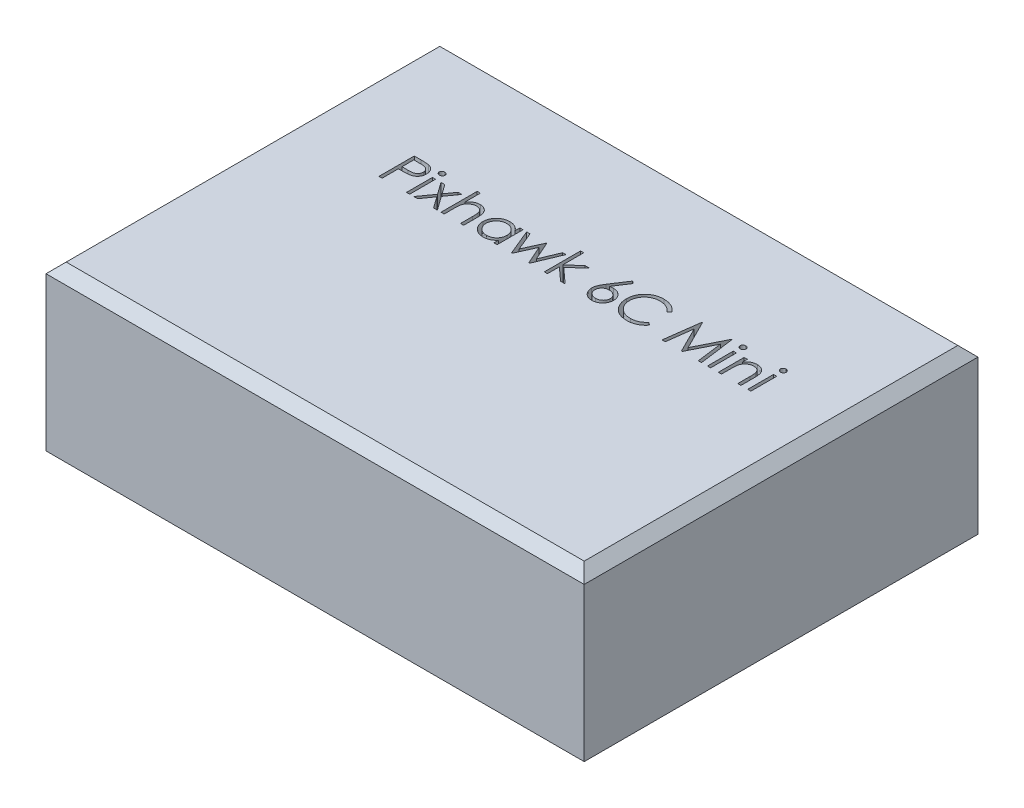
from build123d import *

# Parameters (mm, degrees)
SKETCH_1_W          = 53.3
SKETCH_1_H          = 39
EXTRUDE_1_DEPTH     = 16.2
CHAMFER_1_SIZE      = 1
CHAMFER_2_SIZE      = 1
SKETCH_2_W          = 0.314102564
SKETCH_2_H          = 2.557692308
CUT_EXTRUDE_1_DEPTH = 2


with BuildPart() as part:
    # 草图1 → 凸台-拉伸1 (new body)
    with BuildSketch(Plane(origin=(0, 0, 0), x_dir=(1, 0, 0), z_dir=(0, 1, 0))):
        Rectangle(SKETCH_1_W, SKETCH_1_H)
    extrude(amount=EXTRUDE_1_DEPTH)

    # 倒角1
    chamfer_1_edges = [part.edges().sort_by_distance(p)[0] for p in [
        (0, 16.2, 19.5),
    ]]
    chamfer(chamfer_1_edges, length=CHAMFER_1_SIZE)

    # 倒角2
    chamfer_2_edges = [part.edges().sort_by_distance(p)[0] for p in [
        (26.65, 16.2, -0.5),
        (0, 16.2, -19.5),
        (-26.65, 16.2, -0.5),
    ]]
    chamfer(chamfer_2_edges, length=CHAMFER_2_SIZE)

    # 草图2 → 切除-拉伸1 (cut)
    # profile 1 of 16: a face of its own
    with BuildSketch(Plane(origin=(0, 16.2, 0), x_dir=(1, 0, 0), z_dir=(0, 1, 0))):
        with BuildLine():
            Line((-17.511702096, 7.831163241), (-16.825303859, 7.831163241))
            add(Edge.make_bspline(
                [(-16.825303859, 7.831163241), (-16.778092953, 7.831111345), (-16.68763476, 7.831011909), (-16.557919704, 7.827997163), (-16.440109972, 7.823970471), (-16.334459592, 7.818388578), (-16.240643493, 7.811791988), (-16.159086194, 7.802539948), (-16.089146638, 7.792879653), (-16.047240188, 7.783058246), (-16.028128378, 7.778579106)],
                knots=[0, 0, 0, 0, 1.415646017, 2.712440637, 3.8905458, 4.950247383, 5.884950622, 6.709939814, 7.411656543, 8, 8, 8, 8], degree=3))
            add(Edge.make_bspline(
                [(-16.028128378, 7.778579106), (-16.003934844, 7.771957156), (-15.956117867, 7.758869295), (-15.887216824, 7.732655571), (-15.821662978, 7.701573406), (-15.75923142, 7.666149466), (-15.700689337, 7.624863902), (-15.645163296, 7.579390284), (-15.593143316, 7.528678716), (-15.544921924, 7.473297976), (-15.500637126, 7.414177766), (-15.462507443, 7.350435536), (-15.430580216, 7.283144233), (-15.403196945, 7.212350661), (-15.38348849, 7.137460338), (-15.368641591, 7.058993626), (-15.359217963, 6.976958935), (-15.358315401, 6.920899068), (-15.357855942, 6.892361158)],
                knots=[0, 0, 0, 0, 0.999701418, 1.975846123, 2.934577507, 3.890451536, 4.834027766, 5.787354733, 6.749476667, 7.726910423, 8.712836071, 9.690891519, 10.682875813, 11.679750201, 12.712814741, 13.765529915, 14.8625177, 16, 16, 16, 16], degree=3))
            add(Edge.make_bspline(
                [(-15.357855942, 6.892361158), (-15.358277367, 6.863583381), (-15.359101913, 6.807277717), (-15.368998198, 6.724904929), (-15.38232839, 6.646186538), (-15.402825442, 6.571297088), (-15.429671115, 6.500681318), (-15.461163168, 6.433260086), (-15.499146698, 6.370180414), (-15.542791528, 6.311213296), (-15.591343122, 6.256303384), (-15.644596061, 6.205848589), (-15.702335353, 6.160144251), (-15.764377501, 6.119087907), (-15.83132735, 6.083631628), (-15.902169504, 6.051874323), (-15.97751972, 6.025203262), (-16.029662234, 6.011173201), (-16.05617325, 6.004039843)],
                knots=[0, 0, 0, 0, 1.121902311, 2.195077645, 3.232258892, 4.234102512, 5.217864754, 6.176164875, 7.132989551, 8.084763148, 9.034132444, 9.988522005, 10.94243251, 11.903244335, 12.886203696, 13.894208494, 14.929344452, 16, 16, 16, 16], degree=3))
            add(Edge.make_bspline(
                [(-16.05617325, 6.004039843), (-16.078100584, 5.999376862), (-16.126155611, 5.989157668), (-16.205298333, 5.977749211), (-16.297443719, 5.968011611), (-16.402465999, 5.960710473), (-16.520270904, 5.954460105), (-16.650922161, 5.949492011), (-16.794676239, 5.946762157), (-16.894947483, 5.946621364), (-16.947299051, 5.946547856)],
                knots=[0, 0, 0, 0, 0.601384939, 1.31797006, 2.144135048, 3.087295005, 4.142315834, 5.309527816, 6.595305764, 8, 8, 8, 8], degree=3))
            Line((-16.947299051, 5.946547856), (-17.197599532, 5.946547856))
            Line((-17.197599532, 5.946547856), (-17.197599532, 4.331163241))
            Line((-17.197599532, 4.331163241), (-17.511702096, 4.331163241))
            Line((-17.511702096, 4.331163241), (-17.511702096, 7.831163241))
        make_face()
        with BuildLine():
            Line((-17.197599532, 7.472188882), (-17.197599532, 6.305522215))
            Line((-17.197599532, 6.305522215), (-16.584819083, 6.297809875))
            add(Edge.make_bspline(
                [(-16.584819083, 6.297809875), (-16.554899157, 6.297794412), (-16.497139357, 6.29776456), (-16.413703134, 6.301749783), (-16.336293847, 6.306350316), (-16.265149271, 6.313086239), (-16.200237337, 6.322607497), (-16.141449808, 6.332219235), (-16.089242525, 6.346124597), (-16.028143323, 6.364847666), (-15.960059976, 6.396780282), (-15.885992427, 6.443130172), (-15.823221841, 6.50221088), (-15.768903544, 6.568638712), (-15.725797666, 6.642537841), (-15.694241674, 6.721606778), (-15.675700517, 6.805034627), (-15.673214323, 6.862122766), (-15.671958506, 6.890958914)],
                knots=[0, 0, 0, 0, 1.160613943, 2.240541288, 3.23993089, 4.169200891, 5.011653406, 5.7853311, 6.478053781, 7.106038997, 8.262395093, 9.384106736, 10.481365981, 11.59014053, 12.70357646, 13.786202915, 14.881775077, 16, 16, 16, 16], degree=3))
            add(Edge.make_bspline(
                [(-15.671958506, 6.890958914), (-15.673221153, 6.919097427), (-15.675731138, 6.97503331), (-15.694387001, 7.05701207), (-15.725736315, 7.135247775), (-15.769192909, 7.20822086), (-15.821934039, 7.274409664), (-15.883233382, 7.331906791), (-15.952946644, 7.378128494), (-16.017794875, 7.407961775), (-16.075396061, 7.426177051), (-16.125428021, 7.438921891), (-16.181918695, 7.449097497), (-16.244886475, 7.457337), (-16.313843308, 7.464390461), (-16.389381623, 7.469176439), (-16.471215267, 7.471977895), (-16.528025837, 7.47211685), (-16.557475333, 7.472188882)],
                knots=[0, 0, 0, 0, 1.120700087, 2.227813068, 3.331159281, 4.466773991, 5.599788987, 6.693661531, 7.80175334, 8.91857717, 9.525282508, 10.207424825, 10.974604443, 11.810962634, 12.737642355, 13.736264703, 14.826523623, 16, 16, 16, 16], degree=3))
            Line((-16.557475333, 7.472188882), (-17.197599532, 7.472188882))
        make_face(mode=Mode.SUBTRACT)
    # profile 2 of 16: a face of its own
    with BuildSketch(Plane(origin=(0, 16.2, 0), x_dir=(1, 0, 0), z_dir=(0, 1, 0))):
        with BuildLine():
            add(Edge.make_bspline(
                [(-14.61887357, 7.965778625), (-14.599382255, 7.964874473), (-14.561214515, 7.963103969), (-14.506021247, 7.947942492), (-14.455764235, 7.922242807), (-14.411186502, 7.887763126), (-14.372934615, 7.847213682), (-14.346153905, 7.799952714), (-14.328941509, 7.748894075), (-14.326862954, 7.713278986), (-14.32580466, 7.695145613)],
                knots=[0, 0, 0, 0, 1.055194115, 2.066272739, 3.074728998, 4.095836921, 5.109056067, 6.073838105, 7.019297344, 8, 8, 8, 8], degree=3))
            add(Edge.make_bspline(
                [(-14.32580466, 7.695145613), (-14.32688682, 7.677482959), (-14.329026122, 7.642565984), (-14.34614061, 7.592392512), (-14.373162848, 7.545788229), (-14.411161973, 7.505317519), (-14.455770734, 7.470856899), (-14.50601952, 7.44515216), (-14.561214969, 7.429992022), (-14.599382408, 7.428221334), (-14.61887357, 7.427317087)],
                knots=[0, 0, 0, 0, 0.96129708, 1.900370562, 2.859976407, 3.87933698, 4.906634145, 5.921202961, 6.938410037, 8, 8, 8, 8], degree=3))
            add(Edge.make_bspline(
                [(-14.61887357, 7.427317087), (-14.638141845, 7.428186807), (-14.675645026, 7.429879604), (-14.730011868, 7.445449622), (-14.779840357, 7.470865695), (-14.82450503, 7.50509188), (-14.861735223, 7.546036777), (-14.888833549, 7.592364071), (-14.90590851, 7.642573226), (-14.908053139, 7.677485392), (-14.909137993, 7.695145613)],
                knots=[0, 0, 0, 0, 1.054934014, 2.053291228, 3.073705704, 4.106921865, 5.123545215, 6.088680038, 7.033164197, 8, 8, 8, 8], degree=3))
            add(Edge.make_bspline(
                [(-14.909137993, 7.695145613), (-14.908076907, 7.713276462), (-14.905992866, 7.748886595), (-14.88882075, 7.799981628), (-14.861960942, 7.84696313), (-14.824480378, 7.887988629), (-14.779846918, 7.922234064), (-14.730010173, 7.947645045), (-14.675645473, 7.963216385), (-14.638141997, 7.964908999), (-14.61887357, 7.965778625)],
                knots=[0, 0, 0, 0, 0.98631895, 1.937192651, 2.907499808, 3.917963147, 4.944918757, 5.95915025, 6.951458133, 8, 8, 8, 8], degree=3))
        make_face()
    # profile 3 of 16: a face of its own
    with BuildSketch(Plane(origin=(0, 16.2, 0), x_dir=(1, 0, 0), z_dir=(0, 1, 0))):
        with Locations((-14.617471327, 5.610009395)):
            Rectangle(SKETCH_2_W, SKETCH_2_H)
    # profile 4 of 16: a face of its own
    with BuildSketch(Plane(origin=(0, 16.2, 0), x_dir=(1, 0, 0), z_dir=(0, 1, 0))):
        Polygon((-13.921958506, 6.888855549), (-13.54826059, 6.888855549), (-12.889907224, 5.966179266), (-12.231553859, 6.888855549), (-11.857855942, 6.888855549), (-12.702707705, 5.704660837), (-11.723240557, 4.331163241), (-12.096938474, 4.331163241), (-12.889907224, 5.442441286), (-13.682875974, 4.331163241), (-14.056573891, 4.331163241), (-13.076405622, 5.704660837), align=None)
    # profile 5 of 16: a face of its own
    with BuildSketch(Plane(origin=(0, 16.2, 0), x_dir=(1, 0, 0), z_dir=(0, 1, 0))):
        with BuildLine():
            Line((-11.364266198, 7.920906831), (-11.050163634, 7.920906831))
            Line((-11.050163634, 7.920906831), (-11.050163634, 6.405782632))
            add(Edge.make_bspline(
                [(-11.050163634, 6.405782632), (-11.016446333, 6.447926614), (-10.950797019, 6.529983107), (-10.840300902, 6.637044298), (-10.72683003, 6.729842919), (-10.60646522, 6.803713376), (-10.4814147, 6.862069919), (-10.351151055, 6.903457566), (-10.215650084, 6.928908662), (-10.123624934, 6.93210708), (-10.077006583, 6.933727343)],
                knots=[0, 0, 0, 0, 1.125788106, 2.19196713, 3.20547328, 4.180437432, 5.132270164, 6.079753143, 7.027236121, 8, 8, 8, 8], degree=3))
            add(Edge.make_bspline(
                [(-10.077006583, 6.933727343), (-10.02967619, 6.931981913), (-9.937039195, 6.928565685), (-9.802157732, 6.901552304), (-9.676196857, 6.855394866), (-9.559531014, 6.792227841), (-9.454706317, 6.713555014), (-9.361856553, 6.622723491), (-9.286015754, 6.517449573), (-9.234416637, 6.420193319), (-9.200843229, 6.333654565), (-9.179591403, 6.259418053), (-9.161572205, 6.176696139), (-9.145872469, 6.085531407), (-9.135408887, 5.985486236), (-9.127004269, 5.877011981), (-9.121027815, 5.760114863), (-9.120796211, 5.679194614), (-9.120676455, 5.637353145)],
                knots=[0, 0, 0, 0, 1.235656852, 2.418478516, 3.575258207, 4.727955599, 5.870717718, 6.98870536, 8.107142894, 9.245821548, 9.854588956, 10.528768408, 11.260415777, 12.065282286, 12.943670737, 13.886611085, 14.907229059, 16, 16, 16, 16], degree=3))
            Line((-9.120676455, 5.637353145), (-9.120676455, 4.331163241))
            Line((-9.120676455, 4.331163241), (-9.434779019, 4.331163241))
            Line((-9.434779019, 4.331163241), (-9.434779019, 5.534288241))
            add(Edge.make_bspline(
                [(-9.434779019, 5.534288241), (-9.434969322, 5.56911091), (-9.43533334, 5.635720751), (-9.436536684, 5.731086859), (-9.4392229, 5.817582994), (-9.443563725, 5.894931945), (-9.448129033, 5.963241549), (-9.45441235, 6.022412603), (-9.461722584, 6.072526379), (-9.468291365, 6.102691007), (-9.471237352, 6.116219331)],
                knots=[0, 0, 0, 0, 1.430932559, 2.737130458, 3.918967929, 4.986496826, 5.920444988, 6.731744033, 7.431208747, 8, 8, 8, 8], degree=3))
            add(Edge.make_bspline(
                [(-9.471237352, 6.116219331), (-9.482661597, 6.155913594), (-9.504624642, 6.232225585), (-9.555672619, 6.335887995), (-9.61943163, 6.424272736), (-9.697278892, 6.496187024), (-9.787837256, 6.552598563), (-9.89169722, 6.591666345), (-10.007881289, 6.615914067), (-10.08973276, 6.618353371), (-10.132395205, 6.619624779)],
                knots=[0, 0, 0, 0, 1.090059168, 2.095632401, 3.037101401, 3.955032261, 4.878929692, 5.839099886, 6.873700383, 8, 8, 8, 8], degree=3))
            add(Edge.make_bspline(
                [(-10.132395205, 6.619624779), (-10.157662978, 6.619148953), (-10.207667248, 6.618207305), (-10.281815914, 6.608753406), (-10.353744978, 6.593304688), (-10.424147156, 6.572400149), (-10.491530353, 6.543954613), (-10.557858678, 6.511024423), (-10.621252887, 6.470716168), (-10.682838704, 6.425490401), (-10.740156237, 6.375420641), (-10.793483353, 6.322573686), (-10.841021693, 6.266298722), (-10.884090284, 6.207498606), (-10.92126857, 6.145366812), (-10.953721652, 6.080502494), (-10.981257348, 6.012820348), (-10.99494004, 5.965845287), (-11.001786231, 5.942341125)],
                knots=[0, 0, 0, 0, 1.024319606, 2.027102035, 3.025350316, 4.005802111, 5.00026367, 5.987881639, 7.005602596, 8.042517216, 9.083927026, 10.089214625, 11.084353441, 12.06828073, 13.041928858, 14.016821737, 15.00770877, 16, 16, 16, 16], degree=3))
            add(Edge.make_bspline(
                [(-11.001786231, 5.942341125), (-11.005725658, 5.925320175), (-11.014310155, 5.888229428), (-11.023624988, 5.827055104), (-11.031962785, 5.755968732), (-11.039011334, 5.675078131), (-11.043334421, 5.584086889), (-11.047992661, 5.48361593), (-11.049726675, 5.373035909), (-11.050013628, 5.296140402), (-11.050163634, 5.255942888)],
                knots=[0, 0, 0, 0, 0.607992626, 1.324890765, 2.152360218, 3.099583803, 4.150613268, 5.323148443, 6.60066238, 8, 8, 8, 8], degree=3))
            Line((-11.050163634, 5.255942888), (-11.050163634, 4.331163241))
            Line((-11.050163634, 4.331163241), (-11.364266198, 4.331163241))
            Line((-11.364266198, 4.331163241), (-11.364266198, 7.920906831))
        make_face()
    # profile 6 of 16: a face of its own
    with BuildSketch(Plane(origin=(0, 16.2, 0), x_dir=(1, 0, 0), z_dir=(0, 1, 0))):
        with BuildLine():
            Line((-5.800163634, 6.888855549), (-5.800163634, 4.331163241))
            Line((-5.800163634, 4.331163241), (-6.114266198, 4.331163241))
            Line((-6.114266198, 4.331163241), (-6.114266198, 4.773571093))
            add(Edge.make_bspline(
                [(-6.114266198, 4.773571093), (-6.149684989, 4.733531499), (-6.218805204, 4.655393728), (-6.334246322, 4.553311556), (-6.4566145, 4.468933234), (-6.585315821, 4.400783319), (-6.720234065, 4.349591262), (-6.861070152, 4.313205103), (-7.007881533, 4.289811268), (-7.108133888, 4.287475246), (-7.158937673, 4.286291446)],
                knots=[0, 0, 0, 0, 1.074387032, 2.096679803, 3.090159297, 4.057316773, 5.018401886, 5.985159533, 6.978961417, 8, 8, 8, 8], degree=3))
            add(Edge.make_bspline(
                [(-7.158937673, 4.286291446), (-7.204105627, 4.287517818), (-7.293178832, 4.289936279), (-7.424207909, 4.308698582), (-7.550300158, 4.338829204), (-7.671574731, 4.380730093), (-7.787246876, 4.436310915), (-7.898306973, 4.502852163), (-8.004179665, 4.582092993), (-8.103251204, 4.672681022), (-8.194483204, 4.771076009), (-8.274544477, 4.876021556), (-8.341297557, 4.987063859), (-8.397117637, 5.102797013), (-8.440113982, 5.224111933), (-8.470087616, 5.350589101), (-8.488828063, 5.482078974), (-8.491245524, 5.571618497), (-8.492471327, 5.617020613)],
                knots=[0, 0, 0, 0, 1.033919861, 2.038935746, 3.024066025, 3.998881131, 4.97069526, 5.957263378, 6.95902576, 7.993208707, 9.027059324, 10.027763471, 11.009749337, 11.988697705, 12.965288445, 13.950418724, 14.960734635, 16, 16, 16, 16], degree=3))
            add(Edge.make_bspline(
                [(-8.492471327, 5.617020613), (-8.491218355, 5.661484316), (-8.488741298, 5.74938666), (-8.470288079, 5.878665358), (-8.43925707, 6.003183618), (-8.395709222, 6.122540561), (-8.339867267, 6.236880612), (-8.27193918, 6.346284637), (-8.191920056, 6.451054034), (-8.099667649, 6.548725261), (-7.999732878, 6.638945875), (-7.892824148, 6.717354921), (-7.781600866, 6.785071769), (-7.664337856, 6.838725246), (-7.542770751, 6.88213435), (-7.415817305, 6.912167318), (-7.284005726, 6.92986464), (-7.194515234, 6.932427404), (-7.149121968, 6.933727343)],
                knots=[0, 0, 0, 0, 1.020392517, 2.01726096, 2.990465484, 3.961182959, 4.928053699, 5.906110375, 6.912531644, 7.948652711, 8.985773172, 9.998621852, 10.987621588, 11.969261332, 12.953316658, 13.946091881, 14.958173133, 16, 16, 16, 16], degree=3))
            add(Edge.make_bspline(
                [(-7.149121968, 6.933727343), (-7.096922109, 6.932289592), (-6.994560649, 6.929470229), (-6.844832639, 6.906007502), (-6.703188162, 6.866369034), (-6.568533809, 6.812451536), (-6.441353123, 6.740802807), (-6.322850139, 6.650422846), (-6.211784656, 6.541881659), (-6.147404364, 6.458511215), (-6.114266198, 6.415598337)],
                knots=[0, 0, 0, 0, 1.038897134, 2.037228247, 3.008116434, 3.962042015, 4.918381754, 5.904844433, 6.921570401, 8, 8, 8, 8], degree=3))
            Line((-6.114266198, 6.415598337), (-6.114266198, 6.888855549))
            Line((-6.114266198, 6.888855549), (-5.800163634, 6.888855549))
        make_face()
        with BuildLine():
            add(Edge.make_bspline(
                [(-7.144915237, 6.619624779), (-7.190829575, 6.617991142), (-7.281457175, 6.614766601), (-7.414501177, 6.589593105), (-7.541814591, 6.547708511), (-7.662760665, 6.49042661), (-7.775428882, 6.418397873), (-7.876122553, 6.33127649), (-7.965665254, 6.231439476), (-8.040973518, 6.119337365), (-8.102364015, 5.999159274), (-8.145531047, 5.873534836), (-8.174000295, 5.744729859), (-8.176908815, 5.657367173), (-8.178368763, 5.613515004)],
                knots=[0, 0, 0, 0, 1.031046209, 2.035121221, 3.029706178, 4.034933723, 5.034054252, 6.02443088, 7.017295772, 8.038157696, 9.050218397, 10.03989886, 11.016116709, 12, 12, 12, 12], degree=3))
            add(Edge.make_bspline(
                [(-8.178368763, 5.613515004), (-8.176503869, 5.569924896), (-8.172781392, 5.482915541), (-8.146030698, 5.353934964), (-8.101150825, 5.228280922), (-8.039908762, 5.107019928), (-7.963222137, 4.994435828), (-7.874333485, 4.892695705), (-7.772383203, 4.805206117), (-7.659455696, 4.731968543), (-7.538847726, 4.672806023), (-7.412013794, 4.631640383), (-7.281338156, 4.605062602), (-7.192485822, 4.601958126), (-7.147719724, 4.60039401)],
                knots=[0, 0, 0, 0, 0.979072187, 1.954306742, 2.945804271, 3.96968567, 4.997920485, 5.998718438, 6.996577872, 8.005894225, 9.015743152, 10.005417472, 10.995077863, 12, 12, 12, 12], degree=3))
            add(Edge.make_bspline(
                [(-7.147719724, 4.60039401), (-7.102273221, 4.602053974), (-7.011884635, 4.605355478), (-6.878445927, 4.630636743), (-6.748950964, 4.672405541), (-6.625163736, 4.730304668), (-6.509847605, 4.802062024), (-6.406349727, 4.886069115), (-6.318833759, 4.983772299), (-6.244641149, 5.091148752), (-6.186465732, 5.208860749), (-6.144089673, 5.334194939), (-6.119035767, 5.467155687), (-6.115878038, 5.558019614), (-6.114266198, 5.60440042)],
                knots=[0, 0, 0, 0, 1.01762866, 2.023962475, 3.030623092, 4.058876274, 5.077231937, 6.066672613, 7.034107872, 8.005628644, 8.981990164, 9.965428785, 10.961468474, 12, 12, 12, 12], degree=3))
            add(Edge.make_bspline(
                [(-6.114266198, 5.60440042), (-6.115225855, 5.639738251), (-6.117114762, 5.709294284), (-6.131545332, 5.811421802), (-6.154500258, 5.909155528), (-6.186846428, 6.002598217), (-6.229337713, 6.091233232), (-6.280585479, 6.175696992), (-6.341490928, 6.255550204), (-6.411073624, 6.329693275), (-6.487238827, 6.397319737), (-6.567833368, 6.457683978), (-6.653812115, 6.507272751), (-6.743729151, 6.548314022), (-6.837740486, 6.580973172), (-6.936611106, 6.602760866), (-7.039290093, 6.617721187), (-7.109336148, 6.618983568), (-7.144915237, 6.619624779)],
                knots=[0, 0, 0, 0, 1.050140795, 2.067009409, 3.05949893, 4.030605086, 5.00011959, 5.97591094, 6.962425594, 7.979863591, 8.993523472, 9.986985069, 10.967611495, 11.937549037, 12.921786183, 13.919465291, 14.943216303, 16, 16, 16, 16], degree=3))
        make_face(mode=Mode.SUBTRACT)
    # profile 7 of 16: a face of its own
    with BuildSketch(Plane(origin=(0, 16.2, 0), x_dir=(1, 0, 0), z_dir=(0, 1, 0))):
        Polygon((-5.441189275, 6.888855549), (-5.103949692, 6.888855549), (-4.341830301, 5.049111959), (-3.506794243, 6.888855549), (-3.453508987, 6.888855549), (-2.636702096, 5.049111959), (-1.867571487, 6.888855549), (-1.537343122, 6.888855549), (-2.606553859, 4.331163241), (-2.671758186, 4.331163241), (-3.489266198, 6.170906831), (-4.323601134, 4.331163241), (-4.381794243, 4.331163241), align=None)
    # profile 8 of 16: a face of its own
    with BuildSketch(Plane(origin=(0, 16.2, 0), x_dir=(1, 0, 0), z_dir=(0, 1, 0))):
        Polygon((-1.133496968, 7.920906831), (-0.819394404, 7.920906831), (-0.819394404, 5.845586318), (0.344467776, 6.888855549), (0.795990212, 6.888855549), (-0.554370365, 5.677317087), (0.930605596, 4.331163241), (0.479784282, 4.331163241), (-0.819394404, 5.509748978), (-0.819394404, 4.331163241), (-1.133496968, 4.331163241), align=None)
    # profile 9 of 16: a face of its own
    with BuildSketch(Plane(origin=(0, 16.2, 0), x_dir=(1, 0, 0), z_dir=(0, 1, 0))):
        with BuildLine():
            Line((4.026759443, 7.920906831), (4.268646462, 7.730902824))
            Line((4.268646462, 7.730902824), (3.343866814, 6.316740164))
            add(Edge.make_bspline(
                [(3.343866814, 6.316740164), (3.405437091, 6.326554025), (3.525536878, 6.345697069), (3.647102777, 6.348855015), (3.706346782, 6.35039401)],
                knots=[0, 0, 0, 0, 1.025318673, 2, 2, 2, 2], degree=3))
            add(Edge.make_bspline(
                [(3.706346782, 6.35039401), (3.741919279, 6.349437898), (3.811942679, 6.347555821), (3.914749481, 6.33307197), (4.013538417, 6.310246858), (4.107900029, 6.276974602), (4.198173011, 6.234472248), (4.284875407, 6.183533378), (4.366377418, 6.121527697), (4.443728597, 6.052262742), (4.513955694, 5.975545757), (4.57613175, 5.89414442), (4.628358541, 5.808143539), (4.670732463, 5.717586673), (4.703637342, 5.622613414), (4.727624987, 5.523345274), (4.74180458, 5.419713803), (4.74373007, 5.349235628), (4.74470816, 5.313434875)],
                knots=[0, 0, 0, 0, 1.04369286, 2.054478336, 3.041073146, 4.015093852, 4.984733326, 5.965804835, 6.960378782, 7.985147595, 9.009457201, 10.008161701, 10.986880575, 11.956520048, 12.937015923, 13.931873656, 14.949455224, 16, 16, 16, 16], degree=3))
            add(Edge.make_bspline(
                [(4.74470816, 5.313434875), (4.743285056, 5.264455172), (4.740484722, 5.168074706), (4.712580926, 5.027697999), (4.669221281, 4.893965484), (4.607243753, 4.769012312), (4.53026137, 4.653009743), (4.436383777, 4.550224277), (4.328940289, 4.45855424), (4.207453491, 4.381897621), (4.076710527, 4.31929457), (3.939358529, 4.274329328), (3.796731383, 4.246645858), (3.699926775, 4.243175256), (3.65095816, 4.241419651)],
                knots=[0, 0, 0, 0, 1.031375318, 2.029502543, 3.004789286, 3.987476834, 4.960371455, 5.9300674, 6.912260825, 7.929083631, 8.949397511, 9.960523116, 10.96833055, 12, 12, 12, 12], degree=3))
            add(Edge.make_bspline(
                [(3.65095816, 4.241419651), (3.60386146, 4.242947857), (3.510571142, 4.245974965), (3.373338348, 4.272940903), (3.24147533, 4.316648006), (3.115905949, 4.376862284), (2.999585336, 4.452920167), (2.8955197, 4.544482446), (2.804227925, 4.649591911), (2.728253304, 4.768232258), (2.667994573, 4.895722216), (2.622804647, 5.028659372), (2.596408404, 5.166559354), (2.592719847, 5.260040493), (2.590862007, 5.307124779)],
                knots=[0, 0, 0, 0, 1.012016664, 2.004627821, 2.994792927, 3.992885782, 4.990978636, 5.973936114, 6.964471063, 7.975201453, 8.993600317, 9.990122807, 10.98767138, 12, 12, 12, 12], degree=3))
            add(Edge.make_bspline(
                [(2.590862007, 5.307124779), (2.592043452, 5.343169363), (2.594455737, 5.416765515), (2.611299127, 5.528229542), (2.638363922, 5.642280624), (2.668674168, 5.739034818), (2.700699778, 5.81829634), (2.727352318, 5.88219983), (2.760526314, 5.947960904), (2.795899695, 6.01783454), (2.836656564, 6.090019972), (2.880972213, 6.165723642), (2.930071864, 6.243741569), (2.964492027, 6.296685765), (2.982087968, 6.323751382)],
                knots=[0, 0, 0, 0, 1.173818275, 2.396712641, 3.66331629, 4.989737886, 5.693666774, 6.447286557, 7.243889047, 8.091586357, 8.998013824, 9.943181721, 10.948533338, 12, 12, 12, 12], degree=3))
            Line((2.982087968, 6.323751382), (4.026759443, 7.920906831))
        make_face()
        with BuildLine():
            add(Edge.make_bspline(
                [(3.640441334, 5.991419651), (3.613779089, 5.990641607), (3.561699979, 5.989121862), (3.485292565, 5.98029661), (3.412979313, 5.963677545), (3.343802179, 5.942511213), (3.279054477, 5.913408153), (3.218265637, 5.878056354), (3.161200585, 5.836435176), (3.108457033, 5.789134265), (3.06063737, 5.737346232), (3.019456239, 5.68187671), (2.983933839, 5.624062506), (2.95505202, 5.563420564), (2.932561944, 5.499974065), (2.916293693, 5.434014815), (2.907239942, 5.365100509), (2.905733711, 5.318368006), (2.904964571, 5.294504587)],
                knots=[0, 0, 0, 0, 1.129588631, 2.206414736, 3.251139165, 4.268635594, 5.265702196, 6.250456724, 7.242448911, 8.251968645, 9.246821453, 10.222880186, 11.173611482, 12.116736599, 13.062300278, 14.020270554, 14.989073742, 16, 16, 16, 16], degree=3))
            add(Edge.make_bspline(
                [(2.904964571, 5.294504587), (2.905590932, 5.270854607), (2.906819134, 5.224480517), (2.917971454, 5.156141338), (2.935006536, 5.090376429), (2.960346932, 5.027524831), (2.99057382, 4.966628513), (3.030479144, 4.909893227), (3.07469593, 4.853873157), (3.127549864, 4.802871686), (3.184273226, 4.755415061), (3.244874429, 4.713934808), (3.308034389, 4.678448635), (3.374605811, 4.650637537), (3.443644195, 4.62781325), (3.515724749, 4.611751771), (3.590897604, 4.602671245), (3.641819542, 4.601163051), (3.667785084, 4.60039401)],
                knots=[0, 0, 0, 0, 0.989467248, 1.94019797, 2.891935182, 3.827694429, 4.772920941, 5.730924762, 6.725747692, 7.756678648, 8.79901574, 9.819492441, 10.826891316, 11.826466727, 12.835195252, 13.867842842, 14.912794438, 16, 16, 16, 16], degree=3))
            add(Edge.make_bspline(
                [(3.667785084, 4.60039401), (3.693750582, 4.601163111), (3.744672437, 4.602671423), (3.819845897, 4.611751092), (3.891924216, 4.62781574), (3.960970724, 4.65062851), (4.027512155, 4.67848212), (4.090616877, 4.71371404), (4.15064497, 4.755670157), (4.20740557, 4.802790586), (4.260039508, 4.854163438), (4.305316787, 4.90939316), (4.34400002, 4.967087055), (4.375434207, 5.027284945), (4.400495499, 5.090414433), (4.417616966, 5.156131157), (4.428746255, 5.224483183), (4.429977621, 5.270855507), (4.430605596, 5.294504587)],
                knots=[0, 0, 0, 0, 1.087397944, 2.132534446, 3.165364764, 4.174271784, 5.174024072, 6.181601208, 7.194203697, 8.236725232, 9.267838612, 10.269026844, 11.221737037, 12.171628256, 13.107553087, 14.05945871, 15.010357665, 16, 16, 16, 16], degree=3))
            add(Edge.make_bspline(
                [(4.430605596, 5.294504587), (4.430055303, 5.318399138), (4.428975257, 5.36529637), (4.416759309, 5.433983989), (4.399816935, 5.500309195), (4.374233904, 5.563855144), (4.340997359, 5.624371071), (4.300513952, 5.682162672), (4.253681382, 5.737673019), (4.199583842, 5.789235828), (4.140693608, 5.836382906), (4.078078023, 5.878002462), (4.012570049, 5.913127439), (3.944236107, 5.942434541), (3.872293224, 5.963584015), (3.797902885, 5.980237258), (3.720113642, 5.989099276), (3.667337034, 5.990636341), (3.640441334, 5.991419651)],
                knots=[0, 0, 0, 0, 0.978206639, 1.919901502, 2.851605144, 3.780102724, 4.718870031, 5.675451981, 6.667674623, 7.690630536, 8.733308323, 9.756129687, 10.767539656, 11.776269907, 12.797430371, 13.836405707, 14.897401972, 16, 16, 16, 16], degree=3))
        make_face(mode=Mode.SUBTRACT)
    # profile 10 of 16: a face of its own
    with BuildSketch(Plane(origin=(0, 16.2, 0), x_dir=(1, 0, 0), z_dir=(0, 1, 0))):
        with BuildLine():
            Line((8.648554314, 7.188935677), (8.373714571, 6.978599138))
            add(Edge.make_bspline(
                [(8.373714571, 6.978599138), (8.354108682, 7.001965108), (8.315161236, 7.048382024), (8.252502033, 7.113561568), (8.18720039, 7.17462683), (8.119281269, 7.231868709), (8.047522149, 7.283285475), (7.973661351, 7.331556578), (7.896463306, 7.374824316), (7.789711571, 7.427287302), (7.650063723, 7.482033457), (7.474268884, 7.527936688), (7.290757785, 7.557157864), (7.165560185, 7.560322706), (7.101879635, 7.561932472)],
                knots=[0, 0, 0, 0, 0.757959112, 1.505699292, 2.245454638, 2.979532153, 3.711538275, 4.438200793, 5.171680507, 5.909471876, 7.393775596, 8.890124382, 10.418191784, 12, 12, 12, 12], degree=3))
            add(Edge.make_bspline(
                [(7.101879635, 7.561932472), (7.066796335, 7.561528509), (6.996955343, 7.560724333), (6.893306869, 7.550115208), (6.791593818, 7.535203998), (6.691882352, 7.513078675), (6.594299394, 7.485106056), (6.498206991, 7.451680642), (6.404996392, 7.410325802), (6.313378153, 7.364617542), (6.225598942, 7.312990097), (6.142543895, 7.256676745), (6.064515927, 7.196307649), (5.991453315, 7.131656543), (5.923281366, 7.063014582), (5.860494055, 6.98965024), (5.803308645, 6.911798067), (5.75059162, 6.830484659), (5.703378887, 6.745946868), (5.663849007, 6.657871797), (5.628843885, 6.567767694), (5.601144643, 6.474616533), (5.579220126, 6.379073768), (5.564092462, 6.28088298), (5.553603991, 6.1802493), (5.552803814, 6.112039987), (5.552400468, 6.077657632)],
                knots=[0, 0, 0, 0, 1.054917814, 2.100044995, 3.131103042, 4.146048494, 5.169673617, 6.183595914, 7.203665975, 8.234915748, 9.262203917, 10.264457458, 11.251630812, 12.227803204, 13.197192746, 14.159520551, 15.12972552, 16.100847026, 17.073214652, 18.039054194, 19.002613845, 19.979014051, 20.95965708, 21.949030935, 22.966165397, 24, 24, 24, 24], degree=3))
            add(Edge.make_bspline(
                [(5.552400468, 6.077657632), (5.553662287, 6.025926312), (5.556139701, 5.924358727), (5.578188036, 5.775588117), (5.611693127, 5.633067443), (5.661908704, 5.4976876), (5.723827754, 5.367779242), (5.802068366, 5.245540389), (5.892684903, 5.129123825), (5.996959323, 5.021280877), (6.111365139, 4.922767151), (6.23411305, 4.83601657), (6.364897338, 4.763701687), (6.502273968, 4.703525741), (6.647300082, 4.657269013), (6.799714885, 4.62470489), (6.95918688, 4.603462709), (7.06815628, 4.601429021), (7.12361441, 4.60039401)],
                knots=[0, 0, 0, 0, 1.029171465, 2.020641659, 2.987623507, 3.938342917, 4.889210282, 5.84687017, 6.821220943, 7.821438502, 8.827599549, 9.822697543, 10.807740252, 11.797342354, 12.80366471, 13.83203677, 14.896651826, 16, 16, 16, 16], degree=3))
            add(Edge.make_bspline(
                [(7.12361441, 4.60039401), (7.184717099, 4.60208279), (7.304981808, 4.605406712), (7.481349835, 4.633565962), (7.6501856, 4.679223879), (7.811498187, 4.743121802), (7.964832833, 4.82618709), (8.110429493, 4.926884967), (8.248411064, 5.0461733), (8.331382346, 5.137256428), (8.373714571, 5.183727343)],
                knots=[0, 0, 0, 0, 1.028121516, 2.023589091, 2.998037872, 3.967518031, 4.937445131, 5.927275754, 6.942489185, 8, 8, 8, 8], degree=3))
            Line((8.373714571, 5.183727343), (8.648554314, 4.97549417))
            add(Edge.make_bspline(
                [(8.648554314, 4.97549417), (8.626436204, 4.946955718), (8.582305929, 4.890015512), (8.510847912, 4.809743802), (8.435570615, 4.734239767), (8.355914905, 4.664112146), (8.272797113, 4.59795768), (8.184724801, 4.537655849), (8.092855768, 4.482364965), (7.997501289, 4.43173804), (7.898762677, 4.386820793), (7.796758242, 4.348367025), (7.691927666, 4.315242136), (7.584266158, 4.287990199), (7.473550401, 4.266719115), (7.360179927, 4.25249944), (7.243910052, 4.242757526), (7.165468631, 4.24186961), (7.125717776, 4.241419651)],
                knots=[0, 0, 0, 0, 0.986787822, 1.968848986, 2.935600012, 3.899624008, 4.868462664, 5.837806735, 6.815139263, 7.798259679, 8.787526145, 9.778297419, 10.776456485, 11.791383307, 12.812564526, 13.85620153, 14.913611965, 16, 16, 16, 16], degree=3))
            add(Edge.make_bspline(
                [(7.125717776, 4.241419651), (7.088074109, 4.241681644), (7.013638419, 4.242199702), (6.903739667, 4.250591869), (6.796750086, 4.262041606), (6.69297546, 4.279281737), (6.591849485, 4.299626077), (6.494288901, 4.326897334), (6.399333691, 4.3574465), (6.30736535, 4.393351487), (6.21830565, 4.433867669), (6.132441839, 4.479659228), (6.049813406, 4.530341093), (5.969607985, 4.584796103), (5.893010402, 4.644773405), (5.819356876, 4.70944004), (5.7482344, 4.778578051), (5.704231715, 4.828432904), (5.682108, 4.853498978)],
                knots=[0, 0, 0, 0, 1.114604814, 2.203992996, 3.262667896, 4.300477797, 5.318619304, 6.316056647, 7.298880507, 8.271930387, 9.238335007, 10.195173496, 11.151986948, 12.108099108, 13.064862484, 14.031167946, 15.010108607, 16, 16, 16, 16], degree=3))
            add(Edge.make_bspline(
                [(5.682108, 4.853498978), (5.646672357, 4.897040167), (5.57622888, 4.983596877), (5.486103196, 5.123882859), (5.408955641, 5.270351067), (5.34657972, 5.423770996), (5.297816987, 5.583798384), (5.264035792, 5.750513898), (5.242084188, 5.92376184), (5.239573899, 6.041598629), (5.238297904, 6.101495773)],
                knots=[0, 0, 0, 0, 0.994628077, 1.977248131, 2.950237994, 3.925870899, 4.908910175, 5.911660606, 6.938484602, 8, 8, 8, 8], degree=3))
            add(Edge.make_bspline(
                [(5.238297904, 6.101495773), (5.239853098, 6.164451226), (5.242912844, 6.288312151), (5.268908639, 6.470086104), (5.310727436, 6.644237503), (5.370124324, 6.810441248), (5.445429675, 6.969571528), (5.538456289, 7.120412733), (5.648123431, 7.263929532), (5.773570999, 7.397944284), (5.911138334, 7.520483636), (6.058457148, 7.62828984), (6.215239095, 7.718007356), (6.379756947, 7.793003519), (6.553242629, 7.850647982), (6.735325998, 7.891001168), (6.925664912, 7.916118285), (7.055527338, 7.919293493), (7.121511045, 7.920906831)],
                knots=[0, 0, 0, 0, 1.032925535, 2.032216505, 3.007276963, 3.968222605, 4.92396291, 5.891752235, 6.871517503, 7.883894988, 8.900124299, 9.891468569, 10.874487609, 11.85992873, 12.854644235, 13.869047385, 14.917252991, 16, 16, 16, 16], degree=3))
            add(Edge.make_bspline(
                [(7.121511045, 7.920906831), (7.161725517, 7.920424692), (7.241326014, 7.919470348), (7.359078667, 7.910164206), (7.473720994, 7.8946506), (7.585331976, 7.87353453), (7.694454592, 7.847327209), (7.800254833, 7.81318691), (7.90335352, 7.774150379), (8.003100428, 7.729191913), (8.099016978, 7.678725172), (8.191073296, 7.623309548), (8.278538155, 7.563013743), (8.362027004, 7.498350567), (8.440143215, 7.427952008), (8.515104693, 7.353754412), (8.584365771, 7.273620588), (8.627118966, 7.217215654), (8.648554314, 7.188935677)],
                knots=[0, 0, 0, 0, 1.096760587, 2.17092713, 3.219439832, 4.250915756, 5.268269357, 6.278326846, 7.281116186, 8.274029601, 9.260640565, 10.235837813, 11.203064059, 12.156899882, 13.114053108, 14.069676657, 15.032185724, 16, 16, 16, 16], degree=3))
        make_face()
    # profile 11 of 16: a face of its own
    with BuildSketch(Plane(origin=(0, 16.2, 0), x_dir=(1, 0, 0), z_dir=(0, 1, 0))):
        Polygon((10.533169699, 4.331163241), (10.995208962, 7.831163241), (11.040080757, 7.831163241), (12.485092776, 4.959368369), (13.926599186, 7.831163241), (13.972172103, 7.831163241), (14.437015853, 4.331163241), (14.121511045, 4.331163241), (13.786374827, 6.849592728), (12.522953353, 4.331163241), (12.452140052, 4.331163241), (11.183810725, 6.855201702), (10.849375628, 4.331163241), align=None)
    # profile 12 of 16: a face of its own
    with BuildSketch(Plane(origin=(0, 16.2, 0), x_dir=(1, 0, 0), z_dir=(0, 1, 0))):
        with BuildLine():
            add(Edge.make_bspline(
                [(15.175998225, 7.965778625), (15.19548954, 7.964874473), (15.23365728, 7.963103969), (15.288850548, 7.947942492), (15.33910756, 7.922242807), (15.383685293, 7.887763126), (15.42193718, 7.847213682), (15.44871789, 7.799952714), (15.465930286, 7.748894075), (15.468008841, 7.713278986), (15.469067135, 7.695145613)],
                knots=[0, 0, 0, 0, 1.055194115, 2.066272739, 3.074728998, 4.095836921, 5.109056067, 6.073838105, 7.019297344, 8, 8, 8, 8], degree=3))
            add(Edge.make_bspline(
                [(15.469067135, 7.695145613), (15.467984975, 7.677482959), (15.465845673, 7.642565984), (15.448731185, 7.592392512), (15.421708947, 7.545788229), (15.383709821, 7.505317519), (15.33910106, 7.470856899), (15.288852275, 7.44515216), (15.233656826, 7.429992022), (15.195489387, 7.428221334), (15.175998225, 7.427317087)],
                knots=[0, 0, 0, 0, 0.96129708, 1.900370562, 2.859976407, 3.87933698, 4.906634145, 5.921202961, 6.938410037, 8, 8, 8, 8], degree=3))
            add(Edge.make_bspline(
                [(15.175998225, 7.427317087), (15.156729949, 7.428186807), (15.119226769, 7.429879604), (15.064859927, 7.445449622), (15.015031438, 7.470865695), (14.970366765, 7.50509188), (14.933136572, 7.546036777), (14.906038246, 7.592364071), (14.888963284, 7.642573226), (14.886818656, 7.677485392), (14.885733802, 7.695145613)],
                knots=[0, 0, 0, 0, 1.054934014, 2.053291228, 3.073705704, 4.106921865, 5.123545215, 6.088680038, 7.033164197, 8, 8, 8, 8], degree=3))
            add(Edge.make_bspline(
                [(14.885733802, 7.695145613), (14.886794888, 7.713276462), (14.888878929, 7.748886595), (14.906051045, 7.799981628), (14.932910853, 7.84696313), (14.970391417, 7.887988629), (15.015024877, 7.922234064), (15.064861622, 7.947645045), (15.119226321, 7.963216385), (15.156729797, 7.964908999), (15.175998225, 7.965778625)],
                knots=[0, 0, 0, 0, 0.98631895, 1.937192651, 2.907499808, 3.917963147, 4.944918757, 5.95915025, 6.951458133, 8, 8, 8, 8], degree=3))
        make_face()
    # profile 13 of 16: a face of its own
    with BuildSketch(Plane(origin=(0, 16.2, 0), x_dir=(1, 0, 0), z_dir=(0, 1, 0))):
        with Locations((15.177400468, 5.610009395)):
            Rectangle(SKETCH_2_W, SKETCH_2_H)
    # profile 14 of 16: a face of its own
    with BuildSketch(Plane(origin=(0, 16.2, 0), x_dir=(1, 0, 0), z_dir=(0, 1, 0))):
        with BuildLine():
            Line((16.097272263, 6.888855549), (16.411374827, 6.888855549))
            Line((16.411374827, 6.888855549), (16.411374827, 6.427517408))
            add(Edge.make_bspline(
                [(16.411374827, 6.427517408), (16.444912462, 6.46936013), (16.509993413, 6.550557394), (16.618377747, 6.657277968), (16.732921647, 6.745223193), (16.85292365, 6.815326987), (16.978546661, 6.868173614), (17.10902493, 6.906339545), (17.245139637, 6.929224373), (17.337704073, 6.932214603), (17.384531878, 6.933727343)],
                knots=[0, 0, 0, 0, 1.12780773, 2.188550248, 3.19190651, 4.159438251, 5.104880172, 6.052711206, 7.014878035, 8, 8, 8, 8], degree=3))
            add(Edge.make_bspline(
                [(17.384531878, 6.933727343), (17.431862513, 6.931982148), (17.52449998, 6.92856638), (17.659378042, 6.901549688), (17.785351435, 6.855404433), (17.901970991, 6.792192363), (18.007098205, 6.713585889), (18.099423056, 6.622008108), (18.175786303, 6.516672024), (18.226983666, 6.418948868), (18.260709314, 6.332260074), (18.281941652, 6.258013324), (18.299972633, 6.175295173), (18.315604381, 6.084355584), (18.326181493, 5.984557393), (18.334523784, 5.876309701), (18.340502479, 5.759647571), (18.340739686, 5.678960943), (18.340862007, 5.637353145)],
                knots=[0, 0, 0, 0, 1.235846778, 2.418850247, 3.575807741, 4.728682307, 5.871620074, 6.994088408, 8.11269785, 9.256955736, 9.865816715, 10.540099792, 11.271859618, 12.076849838, 12.949306005, 13.892391288, 14.913166135, 16, 16, 16, 16], degree=3))
            Line((18.340862007, 5.637353145), (18.340862007, 4.331163241))
            Line((18.340862007, 4.331163241), (18.026759443, 4.331163241))
            Line((18.026759443, 4.331163241), (18.026759443, 5.534288241))
            add(Edge.make_bspline(
                [(18.026759443, 5.534288241), (18.026566235, 5.569110686), (18.02619666, 5.635720097), (18.025031014, 5.73108912), (18.022221207, 5.817575698), (18.018272894, 5.894973066), (18.012493864, 5.963206902), (18.006471232, 6.022416179), (17.999106256, 6.072525721), (17.992543342, 6.102690804), (17.989599987, 6.116219331)],
                knots=[0, 0, 0, 0, 1.430800155, 2.736877192, 3.918605307, 4.986035426, 5.920637409, 6.731861385, 7.431261377, 8, 8, 8, 8], degree=3))
            add(Edge.make_bspline(
                [(17.989599987, 6.116219331), (17.978974456, 6.155930516), (17.958523595, 6.23236226), (17.907989612, 6.336036613), (17.844175431, 6.424234801), (17.766277582, 6.496411522), (17.675048506, 6.552582359), (17.570741364, 6.591556314), (17.454362723, 6.615932583), (17.37250834, 6.618359715), (17.329844378, 6.619624779)],
                knots=[0, 0, 0, 0, 1.084156227, 2.086665306, 3.027808233, 3.945421172, 4.874247719, 5.839848303, 6.874090471, 8, 8, 8, 8], degree=3))
            add(Edge.make_bspline(
                [(17.329844378, 6.619624779), (17.304576695, 6.619148775), (17.254572602, 6.618206774), (17.18042263, 6.608755476), (17.108498457, 6.59329702), (17.038078248, 6.572428383), (16.970570454, 6.543766113), (16.903806163, 6.511236743), (16.840299399, 6.470688531), (16.778696002, 6.42549791), (16.721383194, 6.375418703), (16.668054856, 6.322574192), (16.620516835, 6.266298589), (16.57744816, 6.207498641), (16.540269897, 6.145366803), (16.507816809, 6.080502497), (16.480281114, 6.012820348), (16.466598421, 5.965845287), (16.459752231, 5.942341125)],
                knots=[0, 0, 0, 0, 1.023777757, 2.026029729, 3.023749952, 4.003683103, 4.997618607, 5.993177895, 7.010360494, 8.046726602, 9.087585522, 10.09234134, 11.086953743, 12.070360549, 13.043493632, 14.017870808, 15.008233677, 16, 16, 16, 16], degree=3))
            add(Edge.make_bspline(
                [(16.459752231, 5.942341125), (16.455812582, 5.925085922), (16.447236174, 5.887522248), (16.437972994, 5.825877829), (16.429565418, 5.754567854), (16.42252846, 5.673675537), (16.418223043, 5.582917661), (16.413528646, 5.482681824), (16.411819585, 5.372568335), (16.411527231, 5.295906643), (16.411374827, 5.255942888)],
                knots=[0, 0, 0, 0, 0.615963638, 1.340920617, 2.168419149, 3.115676021, 4.16674242, 5.331190069, 6.6087489, 8, 8, 8, 8], degree=3))
            Line((16.411374827, 5.255942888), (16.411374827, 4.331163241))
            Line((16.411374827, 4.331163241), (16.097272263, 4.331163241))
            Line((16.097272263, 4.331163241), (16.097272263, 6.888855549))
        make_face()
    # profile 15 of 16: a face of its own
    with BuildSketch(Plane(origin=(0, 16.2, 0), x_dir=(1, 0, 0), z_dir=(0, 1, 0))):
        with BuildLine():
            add(Edge.make_bspline(
                [(19.169587968, 7.965778625), (19.189079284, 7.964874473), (19.227247024, 7.963103969), (19.282440291, 7.947942492), (19.332697304, 7.922242807), (19.377275036, 7.887763126), (19.415526923, 7.847213682), (19.442307633, 7.799952714), (19.45952003, 7.748894075), (19.461598585, 7.713278986), (19.462656878, 7.695145613)],
                knots=[0, 0, 0, 0, 1.055194115, 2.066272739, 3.074728998, 4.095836921, 5.109056067, 6.073838105, 7.019297344, 8, 8, 8, 8], degree=3))
            add(Edge.make_bspline(
                [(19.462656878, 7.695145613), (19.461574719, 7.677482959), (19.459435417, 7.642565984), (19.442320928, 7.592392512), (19.415298691, 7.545788229), (19.377299565, 7.505317519), (19.332690804, 7.470856899), (19.282442018, 7.44515216), (19.22724657, 7.429992022), (19.18907913, 7.428221334), (19.169587968, 7.427317087)],
                knots=[0, 0, 0, 0, 0.96129708, 1.900370562, 2.859976407, 3.87933698, 4.906634145, 5.921202961, 6.938410037, 8, 8, 8, 8], degree=3))
            add(Edge.make_bspline(
                [(19.169587968, 7.427317087), (19.150319693, 7.428186807), (19.112816513, 7.429879604), (19.05844967, 7.445449622), (19.008621181, 7.470865695), (18.963956508, 7.50509188), (18.926726315, 7.546036777), (18.89962799, 7.592364071), (18.882553028, 7.642573226), (18.880408399, 7.677485392), (18.879323545, 7.695145613)],
                knots=[0, 0, 0, 0, 1.054934014, 2.053291228, 3.073705704, 4.106921865, 5.123545215, 6.088680038, 7.033164197, 8, 8, 8, 8], degree=3))
            add(Edge.make_bspline(
                [(18.879323545, 7.695145613), (18.880384632, 7.713276462), (18.882468673, 7.748886595), (18.899640789, 7.799981628), (18.926500597, 7.84696313), (18.96398116, 7.887988629), (19.00861462, 7.922234064), (19.058451366, 7.947645045), (19.112816065, 7.963216385), (19.150319541, 7.964908999), (19.169587968, 7.965778625)],
                knots=[0, 0, 0, 0, 0.98631895, 1.937192651, 2.907499808, 3.917963147, 4.944918757, 5.95915025, 6.951458133, 8, 8, 8, 8], degree=3))
        make_face()
    # profile 16 of 16: a face of its own
    with BuildSketch(Plane(origin=(0, 16.2, 0), x_dir=(1, 0, 0), z_dir=(0, 1, 0))):
        with Locations((19.170990212, 5.610009395)):
            Rectangle(SKETCH_2_W, SKETCH_2_H)
    extrude(amount=-CUT_EXTRUDE_1_DEPTH, mode=Mode.SUBTRACT)


solid = part.part
